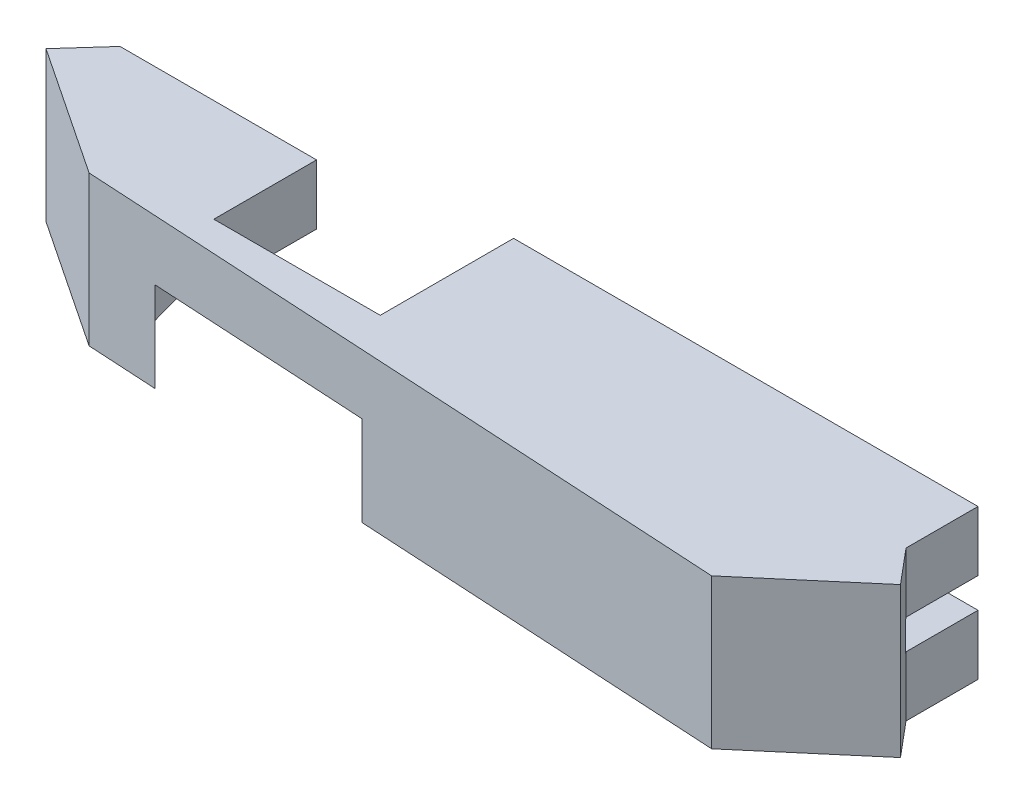
from build123d import *

# Parameters (mm, degrees)
BOSS_EXTRUDE2_DEPTH = 4
BOSS_EXTRUDE3_DEPTH = 2
BOSS_EXTRUDE4_DEPTH = 4
SKETCH5_W           = 5.555
SKETCH5_H           = 3.214115871
CUT_EXTRUDE1_DEPTH  = 6


with BuildPart() as part:
    # Sketch2 → Boss-Extrude2 (new body)
    with BuildSketch(Plane(origin=(0, 0, 0), x_dir=(1, 0, 0), z_dir=(0, 1, 0))):
        Polygon((5.5, 6.858588715), (-7.617234461, 6.858588715), (-9.959191583, 4.257581826), (-1.338261213, -1.486289651), (42.73, -4), (49.538362829, 1.796672871), (47.61, 4.0948062), (47.61, 8.9), (16.61, 8.9), (16.61, 0), (5.5, 0), align=None)
    extrude(amount=BOSS_EXTRUDE2_DEPTH)

    # Sketch2<9> → Boss-Extrude3 (add)
    with BuildSketch(Plane(origin=(0, 0, 0), x_dir=(1, 0, 0), z_dir=(0, 1, 0))):
        with BuildLine():
            Line((-0.115159211, -0.3), (-7.817973643, 6.635645268))
            Line((-7.817973643, 6.635645268), (-9.959191583, 4.257581826))
            Line((-9.959191583, 4.257581826), (-1.338261213, -1.486289651))
            Line((-1.338261213, -1.486289651), (42.73, -4))
            Line((42.73, -4), (49.538362829, 1.796672871))
            Line((49.538362829, 1.796672871), (47.802836283, 3.864992867))
            Line((47.802836283, 3.864992867), (42.83919107, -0.3))
            Line((42.83919107, -0.3), (34.16881591, -0.3))
            Line((34.16881591, -0.3), (34.16881591, 0.607570661))
            ThreePointArc((34.16881591, 0.607570661), (29.26, 4.2), (24.35118409, 0.607570661))
            Line((24.35118409, 0.607570661), (24.35118409, -0.3))
            Line((24.35118409, -0.3), (-0.115159211, -0.3))
        make_face()
    extrude(amount=-BOSS_EXTRUDE3_DEPTH)

    # Sketch4 → Boss-Extrude4 (add)
    with BuildSketch(Plane(origin=(0, -2, 0), x_dir=(-1, 0, 0), z_dir=(0, -1, 0))):
        Polygon((-47.61, 8.9), (-47.61, 4.0948062), (-49.538362829, 1.796672871), (-42.73, -4), (1.338261213, -1.486289651), (9.959191583, 4.257581826), (7.617234461, 6.858588715), (0, 6.858588715), (0, 0), (-24.15118409, 0), (-24.15118409, 8.9), align=None)
    extrude(amount=BOSS_EXTRUDE4_DEPTH)

    # Sketch5 → Cut-Extrude1 (cut)
    with BuildSketch(Plane(origin=(0, -6, 0), x_dir=(-1, 0, 0), z_dir=(0, -1, 0))):
        Polygon((-25.659003688, 8.9), (-23.590958237, 8.9), (-23.590958237, 0), (-24.15118409, 0), align=None)
        Polygon((-23.590958237, 0), (-16.61, -3.214115871), (-16.61, 0), align=None)
        with Locations((-13.8325, -1.607057936)):
            Rectangle(SKETCH5_W, SKETCH5_H)
        with Locations((-8.2775, -1.607057936)):
            Rectangle(SKETCH5_W, SKETCH5_H)
        Polygon((-5.5, -3.214115871), (-0.689386067, 0), (-5.5, 0), align=None)
        Polygon((0, 0), (-0.689386067, 0), (-0.689386067, 6.858588715), (0, 6.858588715), (1.904308615, 6.858588715), align=None)
    extrude(amount=-CUT_EXTRUDE1_DEPTH, mode=Mode.SUBTRACT)


solid = part.part
